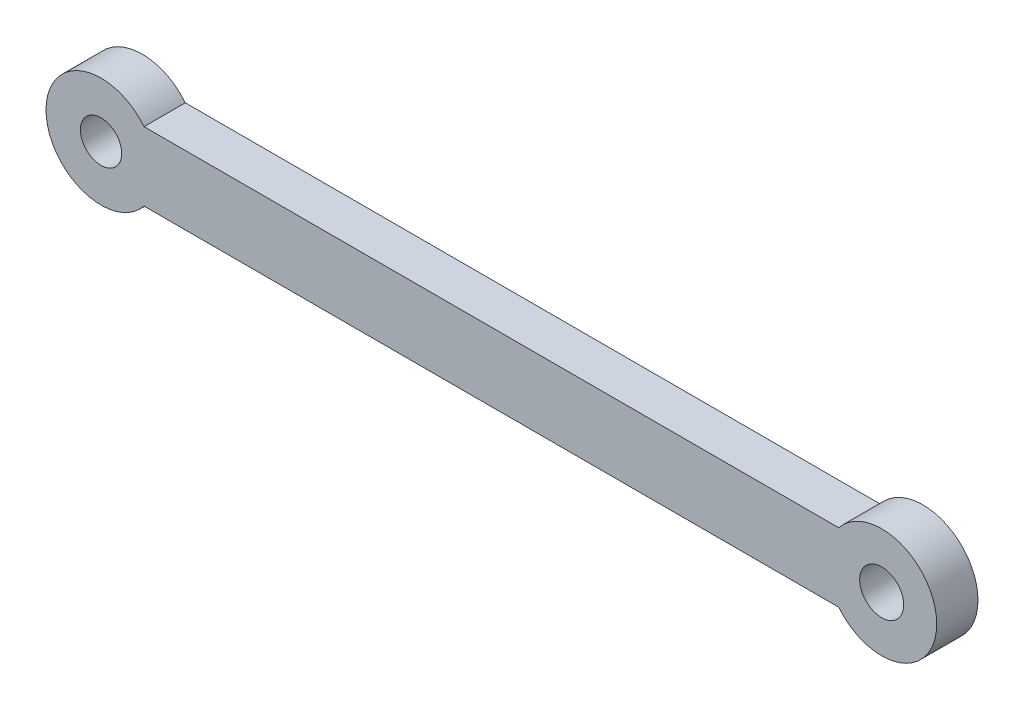
from build123d import *

# Parameters (mm, degrees)
SKETCH1_R           = 1.5
BOSS_EXTRUDE1_DEPTH = 3
SKETCH3_R           = 1.6
CUT_EXTRUDE1_DEPTH  = 3
SKETCH4_R           = 4
SKETCH4_R_2         = 1.6
BOSS_EXTRUDE2_DEPTH = 3
CUT_EXTRUDE2_DEPTH  = 3


with BuildPart() as part:
    # Sketch1 → Boss-Extrude1 (new body)
    with BuildSketch(Plane.XY):
        with BuildLine():
            Line((-26.877501001, -2.5), (30, -2.5))
            Line((30, -2.5), (30, 2.5))
            Line((30, 2.5), (-26.877501001, 2.5))
            ThreePointArc((-26.877501001, 2.5), (-34, 0), (-26.877501001, -2.5))
        make_face()
        with Locations((-30, 0)):
            Circle(SKETCH1_R, mode=Mode.SUBTRACT)
    extrude(amount=BOSS_EXTRUDE1_DEPTH)

    # Sketch3 → Cut-Extrude1 (cut)
    with BuildSketch(Plane.XY.offset(3)):
        with Locations((26.727711113, 0)):
            Circle(SKETCH3_R)
    extrude(amount=-CUT_EXTRUDE1_DEPTH, mode=Mode.SUBTRACT)

    # Sketch4 → Boss-Extrude2 (add)
    with BuildSketch(Plane.XY.offset(3)):
        with Locations((26.727711113, 0)):
            Circle(SKETCH4_R)
        with Locations((26.727711113, 0)):
            Circle(SKETCH4_R_2, mode=Mode.SUBTRACT)
    extrude(amount=-BOSS_EXTRUDE2_DEPTH)

    # Sketch5 → Cut-Extrude2 (cut)
    with BuildSketch(Plane.XY.offset(3)):
        with BuildLine():
            Line((30, 2.5), (29.850210112, 2.5))
            ThreePointArc((29.850210112, 2.5), (29.926661234, 2.4013992), (30, 2.300462005))
            Line((30, 2.300462005), (30, 2.5))
        make_face()
        with BuildLine():
            Line((30, -2.5), (30, -2.300462005))
            ThreePointArc((30, -2.300462005), (29.926661234, -2.4013992), (29.850210112, -2.5))
            Line((29.850210112, -2.5), (30, -2.5))
        make_face()
    extrude(amount=-CUT_EXTRUDE2_DEPTH, mode=Mode.SUBTRACT)


solid = part.part
